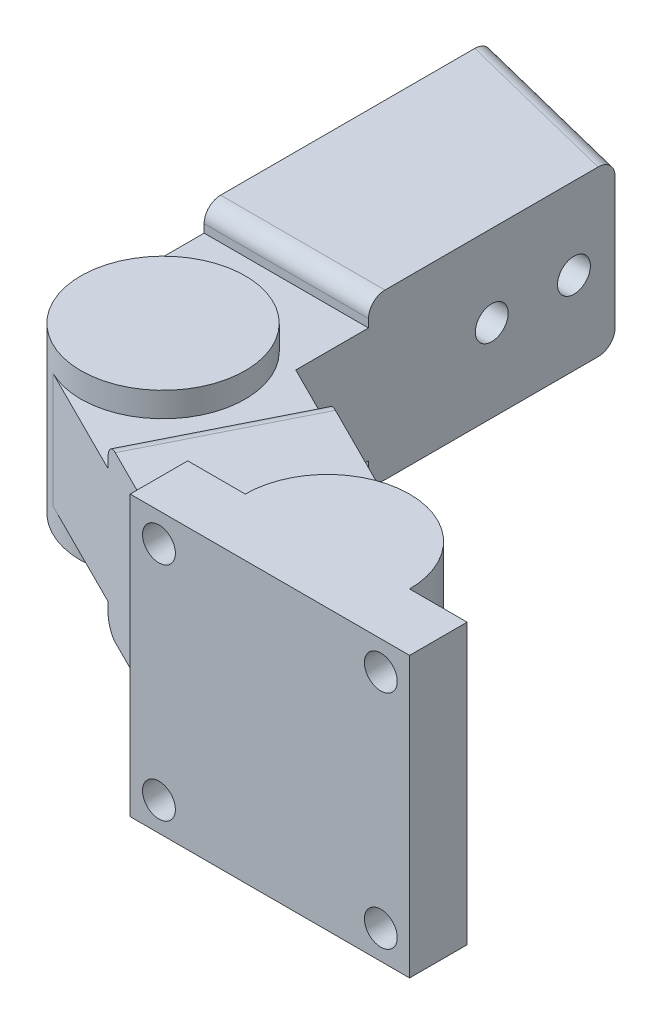
from build123d import *
from build123d.topology import SkipClean

# Parameters (mm, degrees)
SALIENTE_EXTRUIR1_DEPTH      = 20
CORTAR_EXTRUIR1_START        = -3
CORTAR_EXTRUIR1_DEPTH        = 3
CORTAR_EXTRUIR2_DEPTH        = 3
SALIENTE_EXTRUIR4_START      = -20
SALIENTE_EXTRUIR4_DEPTH      = 20
CORTAR_EXTRUIR3_START        = -3
CORTAR_EXTRUIR3_DEPTH        = 3
CORTAR_EXTRUIR4_DEPTH        = 3
CROQUIS9_R                   = 2
CORTAR_EXTRUIR5_DEPTH        = 20
SALIENTE_EXTRUIR5_DEPTH      = 7
SALIENTE_EXTRUIR5_DEPTH_BACK = 27
CROQUIS11_R                  = 2
CORTAR_EXTRUIR6_DEPTH        = 10
REDONDEO1_R                  = 2
REDONDEO3_R                  = 2
CROQUIS12_W                  = 34
CROQUIS12_H                  = 34
CORTAR_EXTRUIR7_DEPTH        = 3


with BuildPart() as part:
    # Croquis1 → Saliente-Extruir1 (new body)
    with BuildSketch(Plane(origin=(0, 0, 0), x_dir=(1, 0, 0), z_dir=(0, 1, 0))):
        with BuildLine():
            Line((-44.472135955, 11.05572809), (-4.472135955, -8.94427191))
            ThreePointArc((-4.472135955, -8.94427191), (9.165086698, -4.000148225), (3.517298828, 9.361015381))
            Line((3.517298828, 9.361015381), (-34.952618119, 28.632724723))
            ThreePointArc((-34.952618119, 28.632724723), (-48.793203604, 24.762307253), (-44.472135955, 11.05572809))
        make_face()
    extrude(amount=SALIENTE_EXTRUIR1_DEPTH)

    # Croquis3 → Cortar-Extruir1 (cut)
    with BuildSketch(Plane(origin=(0, 20, 0), x_dir=(1, 0, 0), z_dir=(0, 1, 0)).offset(CORTAR_EXTRUIR1_START)):
        with BuildLine():
            Line((-34.952618119, 28.632724723), (-22.125927279, 22.20712578))
            Line((-22.125927279, 22.20712578), (-31.05572809, 4.347524158))
            Line((-31.05572809, 4.347524158), (-44.472135955, 11.05572809))
            ThreePointArc((-44.472135955, 11.05572809), (-31.206796396, 15.237692747), (-34.952618119, 28.632724723))
        make_face()
    extrude(amount=CORTAR_EXTRUIR1_DEPTH, mode=Mode.SUBTRACT)

    # Croquis5 → Cortar-Extruir2 (cut)
    with BuildSketch(Plane.XZ):
        with BuildLine():
            Line((-35.508565818, -28.934596744), (-22.125927279, -22.20712578))
            Line((-22.125927279, -22.20712578), (-31.05572809, -4.347524158))
            Line((-31.05572809, -4.347524158), (-44.472135955, -11.05572809))
            ThreePointArc((-44.472135955, -11.05572809), (-31.060560465, -15.518212321), (-35.508565818, -28.934596744))
        make_face()
    extrude(amount=-CORTAR_EXTRUIR2_DEPTH, mode=Mode.SUBTRACT)

    # Croquis6 → Saliente-Extruir4 (add)
    with BuildSketch(Plane(origin=(0, 20, 0), x_dir=(1, 0, 0), z_dir=(0, 1, 0)).offset(SALIENTE_EXTRUIR4_START)):
        with BuildLine():
            ThreePointArc((-50, 20), (-40, 30), (-30, 20))
            Line((-30, 20), (-30, 65))
            Line((-30, 65), (-50, 70))
            Line((-50, 70), (-50, 20))
        make_face()
    extrude(amount=SALIENTE_EXTRUIR4_DEPTH)

    # Croquis7 → Cortar-Extruir3 (cut)
    with BuildSketch(Plane(origin=(0, 20, 0), x_dir=(1, 0, 0), z_dir=(0, 1, 0)).offset(CORTAR_EXTRUIR3_START)):
        with BuildLine():
            Line((-50, 20), (-50, 35))
            Line((-50, 35), (-30, 35))
            Line((-30, 35), (-30, 20))
            ThreePointArc((-30, 20), (-40, 30), (-50, 20))
        make_face()
    extrude(amount=CORTAR_EXTRUIR3_DEPTH, mode=Mode.SUBTRACT)

    # Croquis8 → Cortar-Extruir4 (cut)
    with SkipClean():  # the faces are left unmerged after this step: merging them gives an invalid solid
        with BuildSketch(Plane.XZ):
            with BuildLine():
                Line((-30, -20), (-30, -35))
                Line((-30, -35), (-50, -35))
                Line((-50, -35), (-50, -20))
                ThreePointArc((-50, -20), (-40, -30), (-30, -20))
            make_face()
        extrude(amount=-CORTAR_EXTRUIR4_DEPTH, mode=Mode.SUBTRACT)

    # Croquis9 → Cortar-Extruir5 (cut)
    with SkipClean():  # the faces are left unmerged after this step: merging them gives an invalid solid
        with BuildSketch(Plane(origin=(-30, 0, 0), x_dir=(0, 0, -1), z_dir=(1, 0, 0))):
            with Locations((60, 10.062568572)):
                Circle(CROQUIS9_R)
            with Locations((50, 10.062568572)):
                Circle(CROQUIS9_R)
        extrude(amount=-CORTAR_EXTRUIR5_DEPTH, mode=Mode.SUBTRACT)

    # Croquis10 → Saliente-Extruir5 (add, two sides: drawn at the far end of the back side and taken through both)
    with SkipClean():  # the faces are left unmerged after this step: merging them gives an invalid solid
        with BuildSketch(Plane(origin=(0, 20, 0), x_dir=(1, 0, 0), z_dir=(0, 1, 0)).offset(-SALIENTE_EXTRUIR5_DEPTH_BACK)):
            with BuildLine():
                Line((0, -10), (17, -10))
                Line((17, -10), (17, 0))
                Line((17, 0), (10, 0))
                ThreePointArc((10, 0), (0, 10), (-10, 0))
                Line((-10, 0), (-17, 0))
                Line((-17, 0), (-17, -1.677390217))
                Line((-17, -1.677390217), (-17, -10))
                Line((-17, -10), (0, -10))
            make_face()
        extrude(amount=SALIENTE_EXTRUIR5_DEPTH + SALIENTE_EXTRUIR5_DEPTH_BACK)

    # Croquis11 → Cortar-Extruir6 (cut)
    with SkipClean():  # the faces are left unmerged after this step: merging them gives an invalid solid
        with BuildSketch(Plane(origin=(0, 0, 0), x_dir=(-1, 0, 0), z_dir=(0, 0, -1))):
            with Locations((13.5, 23.5)):
                Circle(CROQUIS11_R)
            with Locations((-13.5, 23.5)):
                Circle(CROQUIS11_R)
            with Locations((-13.5, -3.5)):
                Circle(CROQUIS11_R)
            with Locations((13.5, -3.5)):
                Circle(CROQUIS11_R)
        extrude(amount=-CORTAR_EXTRUIR6_DEPTH, mode=Mode.SUBTRACT)

    # Redondeo1
    redondeo1_edges = [part.edges().sort_by_distance(p)[0] for p in [
        (-26.590827684, 20, -13.277324969),
        (-26.590827684, 0, -13.277324969),
        (-40, 20, -35),
        (-40, 0, -35),
    ]]
    fillet(redondeo1_edges, radius=REDONDEO1_R)

    # Redondeo3
    redondeo3_edges = [part.edges().sort_by_distance(p)[0] for p in [
        (-40, 0, -67.5),
        (-40, 20, -67.5),
    ]]
    fillet(redondeo3_edges, radius=REDONDEO3_R)

    # Croquis12 → Cortar-Extruir7 (cut)
    with SkipClean():  # the faces are left unmerged after this step: merging them gives an invalid solid
        with BuildSketch(Plane.XY.offset(10)):
            with Locations((0, 10)):
                Rectangle(CROQUIS12_W, CROQUIS12_H)
        extrude(amount=-CORTAR_EXTRUIR7_DEPTH, mode=Mode.SUBTRACT)


solid = part.part
